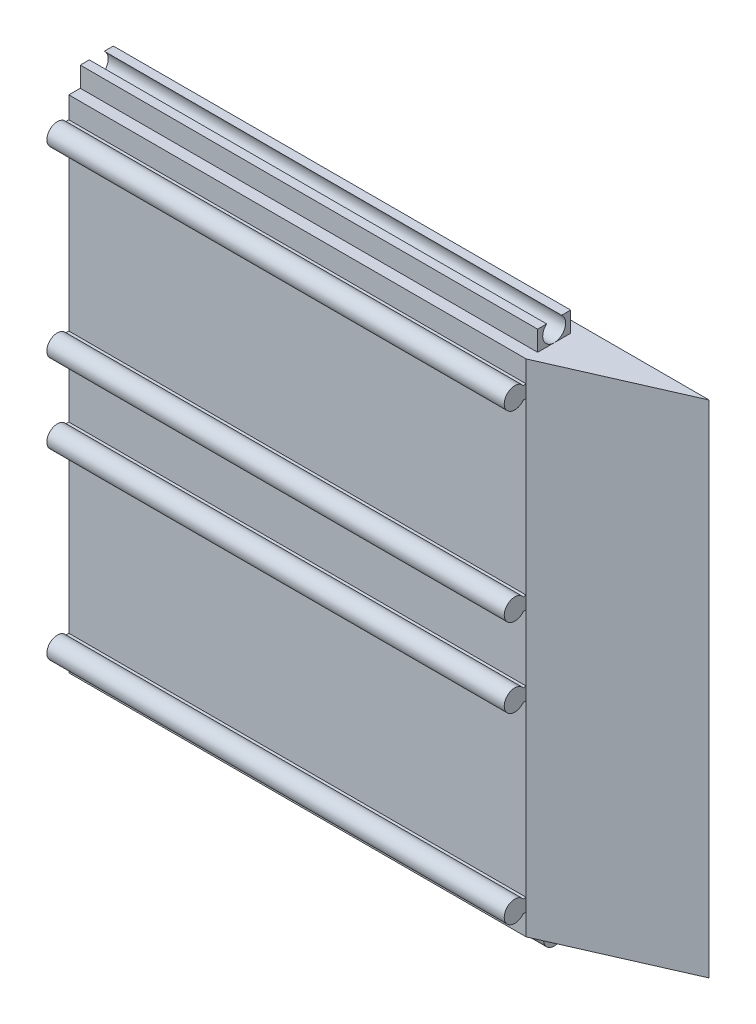
from build123d import *

# Parameters (mm, degrees)
EXTRUDE_1_DEPTH             = 90
SKETCH_2_W                  = 90
SKETCH_2_H                  = 17.75
EXTRUDE_2_DEPTH             = 8.2
SKETCH_3_W                  = 90
SKETCH_3_H                  = 102.45
EXTRUDE_3_DEPTH             = 8.2
SKETCH_4_W                  = 3.95
SKETCH_4_H                  = 2.25
CUT_EXTRUDE_1_DEPTH         = 171.45954982
SKETCH_5_W                  = 3.95
SKETCH_5_H                  = 29.5
CUT_EXTRUDE_2_DEPTH         = 171.45954982
SKETCH_6_W                  = 3.95
SKETCH_6_H                  = 9
CUT_EXTRUDE_3_DEPTH         = 171.45954982
SKETCH_7_W                  = 3.95
SKETCH_7_H                  = 29.5
CUT_EXTRUDE_4_DEPTH         = 171.45954982
SKETCH_8_W                  = 3.95
SKETCH_8_H                  = 6.2
CUT_EXTRUDE_5_DEPTH         = 171.45954982
SKETCH_9_W                  = 2.25
SKETCH_9_H                  = 3.95
CUT_EXTRUDE_6_DEPTH         = 171.45954982
SKETCH_10_W                 = 4.5
SKETCH_10_H                 = 3.95
CUT_EXTRUDE_7_DEPTH         = 171.45954982
SKETCH_11_W                 = 2.25
SKETCH_11_H                 = 3.95
CUT_EXTRUDE_8_DEPTH         = 171.45954982
SKETCH_12_W                 = 20.2
SKETCH_12_H                 = 96.7
CUT_EXTRUDE_9_DEPTH         = 86
HOLE_WIZARD_8_3_8_3_1_D     = 8.3
HOLE_WIZARD_8_3_8_3_1_DEPTH = 3.2
HOLE_WIZARD_4_5_4_5_1_D     = 4.5
HOLE_WIZARD_2_5_2_5_1_D     = 2.5
SKETCH_19_R                 = 4.5030807
EXTRUDE_4_DEPTH             = 3
SKETCH_20_R                 = 1.649948342
SKETCH_20_R_2               = 1.660581376
SKETCH_20_R_3               = 1.430745594
SKETCH_20_R_4               = 1.573250385
SKETCH_20_R_5               = 1.502029841
SKETCH_20_R_6               = 1.53795619
EXTRUDE_5_DEPTH             = 90
CUT_EXTRUDE_10_DEPTH        = 112
CUT_EXTRUDE_10_DEPTH_BACK   = 112
EXTRUDE_6_DEPTH             = 20
EXTRUDE_6_DEPTH_BACK        = 3
SKETCH_22_W                 = 10.1
SKETCH_22_H                 = 96.7
SKETCH_23_W                 = 66
SKETCH_23_H                 = 10.1
EXTRUDE_7_DEPTH             = 10
SKETCH_24_W                 = 66
SKETCH_24_H                 = 10.1
EXTRUDE_8_DEPTH             = 10
SKETCH_25_W                 = 10.1
SKETCH_25_H                 = 76.7
EXTRUDE_9_DEPTH             = 20
SKETCH_26_W                 = 11
SKETCH_26_H                 = 98.5
EXTRUDE_10_DEPTH            = 25
CUT_EXTRUDE_13_DEPTH        = 123
EXTRUDE_11_DEPTH            = 78
EXTRUDE_11_DEPTH_BACK       = 2
SKETCH_29_W                 = 46
SKETCH_29_H                 = 10.1


with BuildPart() as part:
    # Эскиз1 → Бобышка-Вытянуть1 (new body)
    with BuildSketch(Plane(origin=(90, 0, 0), x_dir=(0, 0, -1), z_dir=(1, 0, 0))):
        with BuildLine():
            Line((6.75, 40.906238208), (6.75, 135.75))
            Line((6.75, 135.75), (-11.593761792, 135.75))
            ThreePointArc((-11.593761792, 135.75), (-15.325, 134.5), (-11.593761793, 133.25))
            Line((-11.593761793, 133.25), (-11, 133.25))
            Line((-11, 133.25), (-11, 99.75))
            Line((-11, 99.75), (-11.593761792, 99.75))
            ThreePointArc((-11.593761792, 99.75), (-15.325, 98.5), (-11.593761792, 97.25))
            Line((-11.593761792, 97.25), (-11, 97.25))
            Line((-11, 97.25), (-11, 84.25))
            Line((-11, 84.25), (-11.593761792, 84.25))
            ThreePointArc((-11.593761792, 84.25), (-15.325, 83), (-11.593761792, 81.75))
            Line((-11.593761792, 81.75), (-11, 81.75))
            Line((-11, 81.75), (-11, 48.25))
            Line((-11, 48.25), (-11.593761792, 48.25))
            ThreePointArc((-11.593761792, 48.25), (-15.325, 47), (-11.593761792, 45.75))
            Line((-11.593761792, 45.75), (-11, 45.75))
            Line((-11, 45.75), (-11, 41.5))
            Line((-11, 41.5), (-6.75, 41.5))
            Line((-6.75, 41.5), (-6.75, 40.906238208))
            ThreePointArc((-6.75, 40.906238208), (-5.5, 37.175), (-4.25, 40.906238208))
            Line((-4.25, 40.906238208), (-4.25, 41.5))
            Line((-4.25, 41.5), (4.25, 41.5))
            Line((4.25, 41.5), (4.25, 40.906238208))
            ThreePointArc((4.25, 40.906238208), (5.5, 37.175), (6.75, 40.906238208))
        make_face()
    extrude(amount=-EXTRUDE_1_DEPTH)

    # Эскиз2 → Бобышка-Вытянуть2 (add)
    with BuildSketch(Plane(origin=(0, 135.75, 0), x_dir=(-1, 0, 0), z_dir=(0, 1, 0))):
        with Locations((-45, 2.125)):
            Rectangle(SKETCH_2_W, SKETCH_2_H)
    extrude(amount=EXTRUDE_2_DEPTH)

    # Эскиз3 → Бобышка-Вытянуть3 (add)
    with BuildSketch(Plane(origin=(0, 0, -6.75), x_dir=(-1, 0, 0), z_dir=(0, 0, -1))):
        with Locations((-45, 92.725)):
            Rectangle(SKETCH_3_W, SKETCH_3_H)
    extrude(amount=EXTRUDE_3_DEPTH)

    # Эскиз4 → Вырез-Вытянуть1 (cut, through all)
    with BuildSketch(Plane.ZY):
        with Locations((-12.975, 42.625)):
            Rectangle(SKETCH_4_W, SKETCH_4_H)
    extrude(amount=-CUT_EXTRUDE_1_DEPTH, mode=Mode.SUBTRACT)

    # Эскиз5 → Вырез-Вытянуть2 (cut, through all)
    with BuildSketch(Plane.ZY):
        with Locations((-12.975, 65)):
            Rectangle(SKETCH_5_W, SKETCH_5_H)
    extrude(amount=-CUT_EXTRUDE_2_DEPTH, mode=Mode.SUBTRACT)

    # Эскиз6 → Вырез-Вытянуть3 (cut, through all)
    with BuildSketch(Plane.ZY):
        with Locations((-12.975, 90.75)):
            Rectangle(SKETCH_6_W, SKETCH_6_H)
    extrude(amount=-CUT_EXTRUDE_3_DEPTH, mode=Mode.SUBTRACT)

    # Эскиз7 → Вырез-Вытянуть4 (cut, through all)
    with BuildSketch(Plane.ZY):
        with Locations((-12.975, 116.5)):
            Rectangle(SKETCH_7_W, SKETCH_7_H)
    extrude(amount=-CUT_EXTRUDE_4_DEPTH, mode=Mode.SUBTRACT)

    # Эскиз8 → Вырез-Вытянуть5 (cut, through all)
    with BuildSketch(Plane.ZY):
        with Locations((-12.975, 140.85)):
            Rectangle(SKETCH_8_W, SKETCH_8_H)
    extrude(amount=-CUT_EXTRUDE_5_DEPTH, mode=Mode.SUBTRACT)

    # Эскиз9 → Вырез-Вытянуть6 (cut, through all)
    with BuildSketch(Plane.ZY):
        with Locations((-9.875, 141.975)):
            Rectangle(SKETCH_9_W, SKETCH_9_H)
    extrude(amount=-CUT_EXTRUDE_6_DEPTH, mode=Mode.SUBTRACT)

    # Эскиз10 → Вырез-Вытянуть7 (cut, through all)
    with BuildSketch(Plane.ZY):
        with Locations((0, 141.975)):
            Rectangle(SKETCH_10_W, SKETCH_10_H)
    extrude(amount=-CUT_EXTRUDE_7_DEPTH, mode=Mode.SUBTRACT)

    # Эскиз11 → Вырез-Вытянуть8 (cut, through all)
    with BuildSketch(Plane.ZY):
        with Locations((9.875, 141.975)):
            Rectangle(SKETCH_11_W, SKETCH_11_H)
    extrude(amount=-CUT_EXTRUDE_8_DEPTH, mode=Mode.SUBTRACT)

    # Эскиз12 → Вырез-Вытянуть9 (cut)
    with BuildSketch(Plane(origin=(90, 0, 0), x_dir=(0, 0, -1), z_dir=(1, 0, 0))):
        with Locations((0, 90.75)):
            Rectangle(SKETCH_12_W, SKETCH_12_H)
    extrude(amount=-CUT_EXTRUDE_9_DEPTH, mode=Mode.SUBTRACT)

    # Диаметр отверстия Ø8.3 (8.3)1
    with Locations(Plane.ZY):
        with Locations((0, 90)):
            Hole(HOLE_WIZARD_8_3_8_3_1_D / 2, depth=HOLE_WIZARD_8_3_8_3_1_DEPTH)

    # Диаметр отверстия Ø4.5 (4.5)1 (through all)
    with Locations(Plane.ZY):
        with Locations((-13.25, 47), (-13.25, 83), (-13.25, 98.5), (-13.25, 134.5), (-5.5, 142.25), (5.5, 142.25)):
            Hole(HOLE_WIZARD_4_5_4_5_1_D / 2)

    # Диаметр отверстия Ø2.5 (2.5)1 (through all)
    with Locations(Plane(origin=(90, 0, 0), x_dir=(0, 0, -1), z_dir=(1, 0, 0))):
        with Locations((-13.25, 98.5), (-13.25, 134.5), (-13.25, 47), (-13.25, 83), (5.5, 39.25), (-5.5, 39.25)):
            Hole(HOLE_WIZARD_2_5_2_5_1_D / 2)

    # Эскиз19 → Бобышка-Вытянуть4 (add)
    with BuildSketch(Plane.ZY):
        with Locations((0, 90)):
            Circle(SKETCH_19_R)
    extrude(amount=-EXTRUDE_4_DEPTH)

    # Эскиз20 → Бобышка-Вытянуть5 (add)
    with BuildSketch(Plane(origin=(90, 0, 0), x_dir=(0, 0, -1), z_dir=(1, 0, 0))):
        with Locations((-13.25, 134.5)):
            Circle(SKETCH_20_R)
        with Locations((-13.25, 98.5)):
            Circle(SKETCH_20_R_2)
        with Locations((-13.25, 83)):
            Circle(SKETCH_20_R_3)
        with Locations((-13.25, 47)):
            Circle(SKETCH_20_R_4)
        with Locations((-5.5, 39.25)):
            Circle(SKETCH_20_R_5)
        with Locations((5.5, 39.25)):
            Circle(SKETCH_20_R_6)
    extrude(amount=-EXTRUDE_5_DEPTH)

    # Эскиз21 → Вырез-Вытянуть10 (cut, two sides: drawn at the far end of the back side and taken through both)
    with BuildSketch(Plane(origin=(4, 0, 0), x_dir=(0, 0, -1), z_dir=(1, 0, 0)).offset(-CUT_EXTRUDE_10_DEPTH_BACK)):
        Polygon((0, 140), (0, 41.5), (0, 35.614345614), (18.747428666, 35.614345614), (18.747428666, 145.957941917), (0, 145.957941917), align=None)
    extrude(amount=CUT_EXTRUDE_10_DEPTH + CUT_EXTRUDE_10_DEPTH_BACK, mode=Mode.SUBTRACT)

    # Эскиз22 → Бобышка-Вытянуть6 (add, two sides: drawn at the far end of the back side and taken through both)
    with BuildSketch(Plane(origin=(4, 0, 0), x_dir=(0, 0, -1), z_dir=(1, 0, 0)).offset(-EXTRUDE_6_DEPTH_BACK)):
        with Locations((-5.05, 90.75)):
            Rectangle(SKETCH_22_W, SKETCH_22_H)
    extrude(amount=EXTRUDE_6_DEPTH + EXTRUDE_6_DEPTH_BACK)

    # Эскиз23 → Бобышка-Вытянуть7 (add)
    with BuildSketch(Plane.XZ.offset(-139.1)):
        with Locations((57, 5.05)):
            Rectangle(SKETCH_23_W, SKETCH_23_H)
    extrude(amount=EXTRUDE_7_DEPTH)

    # Эскиз24 → Бобышка-Вытянуть8 (add)
    with BuildSketch(Plane(origin=(0, 42.4, 0), x_dir=(1, 0, 0), z_dir=(0, 1, 0))):
        with Locations((57, -5.05)):
            Rectangle(SKETCH_24_W, SKETCH_24_H)
    extrude(amount=EXTRUDE_8_DEPTH)

    # Эскиз25 → Бобышка-Вытянуть9 (add)
    with BuildSketch(Plane(origin=(90, 0, 0), x_dir=(0, 0, -1), z_dir=(1, 0, 0))):
        with Locations((-5.05, 90.75)):
            Rectangle(SKETCH_25_W, SKETCH_25_H)
    extrude(amount=-EXTRUDE_9_DEPTH)

    # Эскиз26 → Бобышка-Вытянуть10 (add)
    with BuildSketch(Plane(origin=(90, 0, 0), x_dir=(0, 0, -1), z_dir=(1, 0, 0))):
        with Locations((-5.5, 90.75)):
            Rectangle(SKETCH_26_W, SKETCH_26_H)
    extrude(amount=EXTRUDE_10_DEPTH)

    # Эскиз27 → Вырез-Вытянуть13 (cut)
    with BuildSketch(Plane.XZ.offset(-41.5)):
        Polygon((90, 11), (115, 0), (115, 11), align=None)
    extrude(amount=-CUT_EXTRUDE_13_DEPTH, mode=Mode.SUBTRACT)

    # Эскиз29 → Бобышка-Вытянуть11 (add, two sides: drawn at the far end of the back side and taken through both)
    with BuildSketch(Plane.XZ.offset(-129.1).offset(-EXTRUDE_11_DEPTH_BACK)):
        with Locations((47, 5.05)):
            Rectangle(SKETCH_29_W, SKETCH_29_H)
    extrude(amount=EXTRUDE_11_DEPTH + EXTRUDE_11_DEPTH_BACK)


solid = part.part
